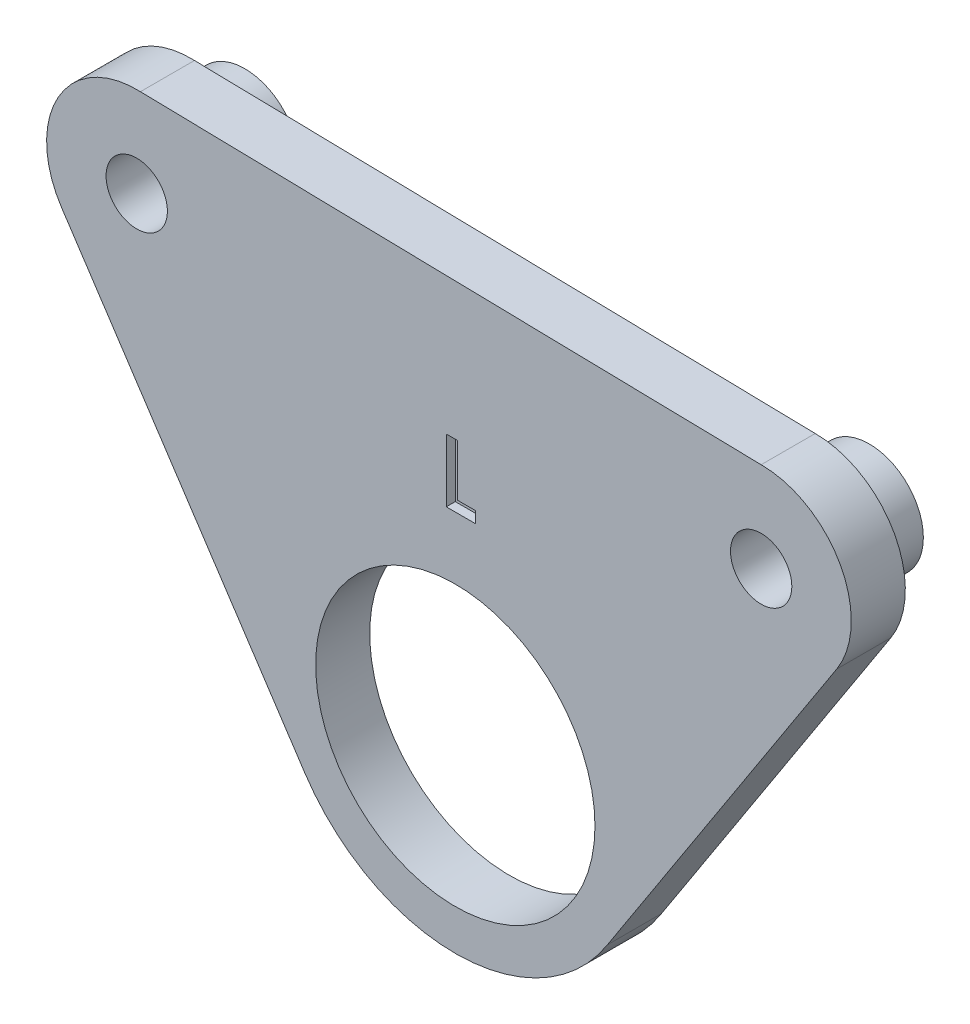
from build123d import *

# Parameters (mm, degrees)
SKETCH1_R           = 7.75
SKETCH1_R_2         = 3
BOSS_EXTRUDE3_DEPTH = 3
BOSS_EXTRUDE4_START = -6
SKETCH3_R           = 3
SKETCH3_R_2         = 1.7025
BOSS_EXTRUDE4_DEPTH = 6
CUT_EXTRUDE1_DEPTH  = 0.5


with BuildPart() as part:
    # Sketch1 → Boss-Extrude3 (new body)
    with BuildSketch(Plane.XY):
        with BuildLine():
            Line((8.434915556, -5.371424351), (21.165047264, 14.249110995))
            ThreePointArc((21.165047264, 14.249110995), (21.364152327, 19.357269814), (16.970562748, 21.970562748))
            Line((16.970562748, 21.970562748), (-17.47367286, 22.673506332))
            ThreePointArc((-17.47367286, 22.673506332), (-22.032126076, 20.135047844), (-21.848877926, 14.920674696))
            Line((-21.848877926, 14.920674696), (-8.342416793, -5.513989668))
            ThreePointArc((-8.342416793, -5.513989668), (0.084971894, -9.999638982), (8.434915556, -5.371424351))
        make_face()
        Circle(SKETCH1_R, mode=Mode.SUBTRACT)
        with Locations((-17.67766953, 17.67766953)):
            Circle(SKETCH1_R_2, mode=Mode.SUBTRACT)
        with Locations((16.970562748, 16.970562748)):
            Circle(SKETCH1_R_2, mode=Mode.SUBTRACT)
    extrude(amount=BOSS_EXTRUDE3_DEPTH)

    # Sketch3 → Boss-Extrude4 (add)
    # profile 1 of 2: a face of its own
    with BuildSketch(Plane.XY.offset(3).offset(BOSS_EXTRUDE4_START)):
        with Locations((-17.67766953, 17.67766953)):
            Circle(SKETCH3_R)
        with Locations((-17.67766953, 17.67766953)):
            Circle(SKETCH3_R_2, mode=Mode.SUBTRACT)
    # profile 2 of 2: a face of its own
    with BuildSketch(Plane.XY.offset(3).offset(BOSS_EXTRUDE4_START)):
        with Locations((16.970562748, 16.970562748)):
            Circle(SKETCH3_R)
        with Locations((16.970562748, 16.970562748)):
            Circle(SKETCH3_R_2, mode=Mode.SUBTRACT)
    extrude(amount=BOSS_EXTRUDE4_DEPTH)

    # Sketch4 → Cut-Extrude1 (cut)
    with BuildSketch(Plane.XY.offset(3)):
        Polygon((-0.501047916, 14.710849075), (0.127157212, 14.710849075), (0.127157212, 11.839054203), (1.1143367, 11.839054203), (1.1143367, 11.210849075), (-0.501047916, 11.210849075), align=None)
    extrude(amount=-CUT_EXTRUDE1_DEPTH, mode=Mode.SUBTRACT)


solid = part.part
